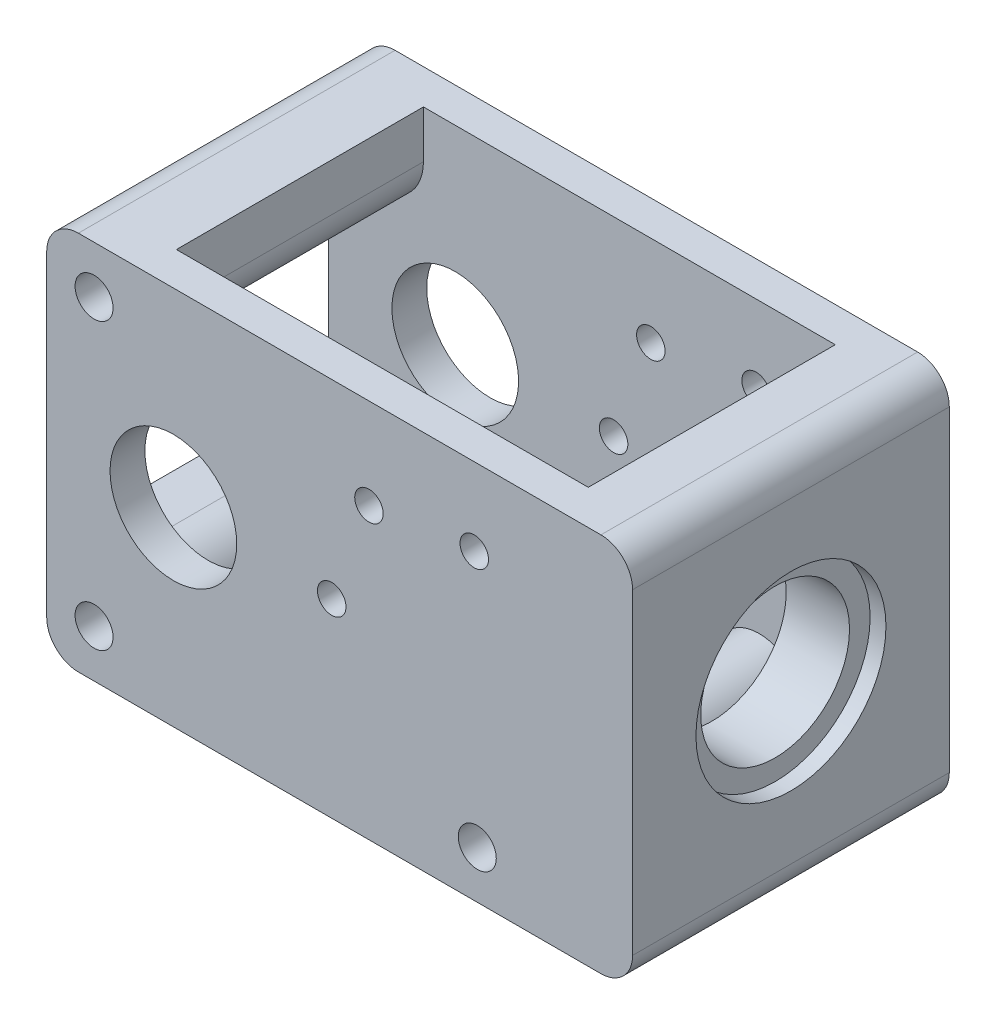
from build123d import *

# Parameters (mm, degrees)
BODYSKE_R   = 2
BODYSKE_R_2 = 0.45
BODYSKE_R_3 = 0.6
BODY_DEPTH  = 5
BOXSKE_R    = 1.4
BOX_DEPTH   = 3.9
HOLESKE_R   = 2.35
HOLE_DEPTH  = 21.081085628
PADSKE_R    = 3
PAD_DEPTH   = 0.5


with BuildPart() as part:
    # BodySke → Body (new, symmetric)
    with BuildSketch(Plane.XY):
        with BuildLine():
            Line((-3, 6), (13.5, 6))
            ThreePointArc((13.5, 6), (14.207106781, 5.707106781), (14.5, 5))
            Line((14.5, 5), (14.5, -5))
            ThreePointArc((14.5, -5), (14.207106781, -5.707106781), (13.5, -6))
            Line((13.5, -6), (-3, -6))
            ThreePointArc((-3, -6), (-3.707106781, -5.707106781), (-4, -5))
            Line((-4, -5), (-4, 5))
            ThreePointArc((-4, 5), (-3.707106781, 5.707106781), (-3, 6))
        make_face()
        Circle(BODYSKE_R, mode=Mode.SUBTRACT)
        with Locations((5, 0)):
            Circle(BODYSKE_R_2, mode=Mode.SUBTRACT)
        with Locations((-2.504495957, 4.5)):
            Circle(BODYSKE_R_3, mode=Mode.SUBTRACT)
        with Locations((-2.504495957, -4.5)):
            Circle(BODYSKE_R_3, mode=Mode.SUBTRACT)
        with Locations((6.175559685, 3.136966596)):
            Circle(BODYSKE_R_2, mode=Mode.SUBTRACT)
        with Locations((9.5, 3.55)):
            Circle(BODYSKE_R_2, mode=Mode.SUBTRACT)
        with Locations((9.595504043, -4.5)):
            Circle(BODYSKE_R_3, mode=Mode.SUBTRACT)
    extrude(amount=BODY_DEPTH, both=True)

    # BoxSke → Box (cut, symmetric)
    with BuildSketch(Plane.XY):
        with BuildLine():
            Line((12, 6), (12, -6))
            Line((12, -6), (-1.004495957, -6))
            Line((-1.004495957, -6), (-1.004495957, -4.5))
            ThreePointArc((-1.004495957, -4.5), (-1.443835785, -3.439339828), (-2.504495957, -3))
            Line((-2.504495957, -3), (-4, -3))
            Line((-4, -3), (-4, 3))
            Line((-4, 3), (-2.504495957, 3))
            ThreePointArc((-2.504495957, 3), (-1.443835785, 3.439339828), (-1.004495957, 4.5))
            Line((-1.004495957, 4.5), (-1.004495957, 6))
            Line((-1.004495957, 6), (12, 6))
        make_face()
        with Locations((9.595504043, -4.5)):
            Circle(BOXSKE_R, mode=Mode.SUBTRACT)
    extrude(amount=BOX_DEPTH, both=True, mode=Mode.SUBTRACT)

    # HoleSke → Hole (cut, through all)
    with BuildSketch(Plane(origin=(14.5, 0, 0), x_dir=(0, 0, -1), z_dir=(1, 0, 0))):
        Circle(HOLESKE_R)
    extrude(amount=-HOLE_DEPTH, mode=Mode.SUBTRACT)

    # PadSke → Pad (cut)
    with BuildSketch(Plane(origin=(14.5, 0, 0), x_dir=(0, 0, -1), z_dir=(1, 0, 0))):
        Circle(PADSKE_R)
    extrude(amount=-PAD_DEPTH, mode=Mode.SUBTRACT)


solid = part.part
